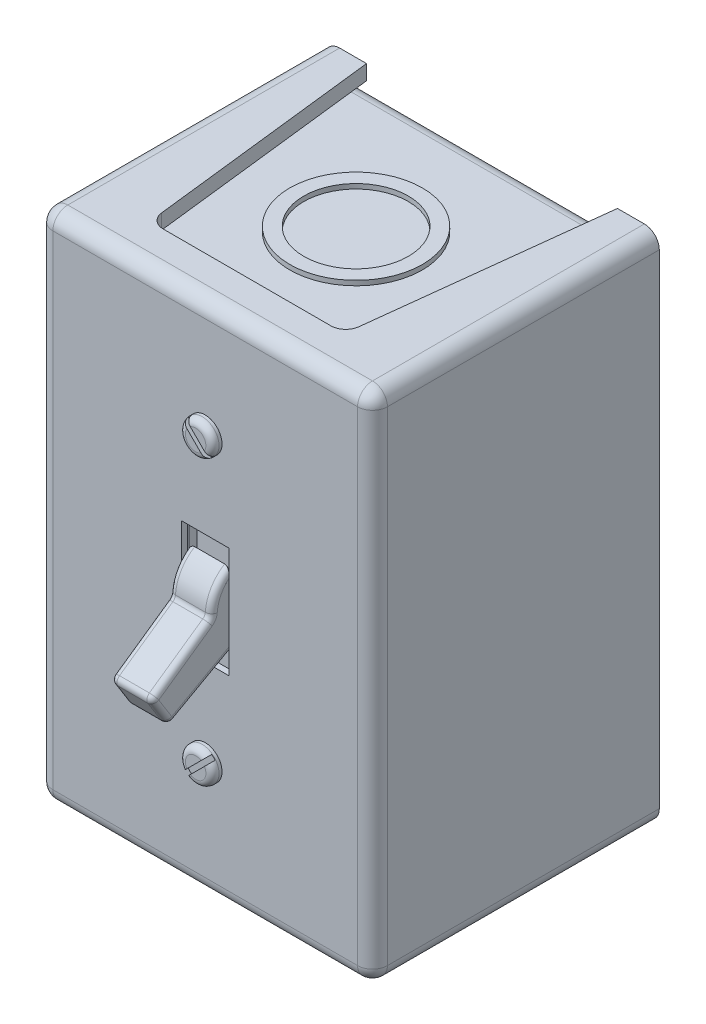
from build123d import *

# Parameters (mm, degrees)
SKETCH1_W               = 71.12
SKETCH1_H               = 109.22
BOSS_EXTRUDE1_DEPTH     = 60.96
FILLET1_R               = 3.175
CUT_EXTRUDE1_DEPTH      = 3.175
SKETCH3_R               = 14.097
SKETCH3_R_2             = 11.1125
BOSS_EXTRUDE5_DEPTH     = 1.016
SKETCH5_W               = 64.77
SKETCH5_H               = 102.87
SKETCH5_W_2             = 63.754
SKETCH5_H_2             = 101.854
CUT_EXTRUDE_THIN1_DEPTH = 53.975
SKETCH4_R               = 3.175
SKETCH4_R_2             = 11.1125
CUT_EXTRUDE3_DEPTH      = 1.016
FILLET6_R               = 3.175
SKETCH9_W               = 10.16
SKETCH9_H               = 23.495
CUT_EXTRUDE6_DEPTH      = 1.27
SKETCH10_W              = 9.525
SKETCH10_H              = 30.1625
CUT_EXTRUDE7_DEPTH      = 1.778
BOSS_EXTRUDE3_DEPTH     = 4.445
FILLET5_R               = 1.27
BODY_MOVE_COPY1_ANGLE   = 32
SKETCH15_R              = 3.57505
BOSS_EXTRUDE6_DEPTH     = 2.032
FILLET7_R               = 1.397
CUT_EXTRUDE_THIN2_DEPTH = 1.27


with BuildPart() as part:
    # Sketch1 → Boss-Extrude1 (new body)
    with BuildSketch(Plane.XY):
        Rectangle(SKETCH1_W, SKETCH1_H)
    extrude(amount=BOSS_EXTRUDE1_DEPTH)

    # Fillet1
    fillet1_edges = [part.edges().sort_by_distance(p)[0] for p in [
        (35.56, 0, 60.96),
        (0, 54.61, 60.96),
        (-35.56, 0, 60.96),
        (0, -54.61, 60.96),
        (-35.56, 54.61, 30.48),
        (35.56, 54.61, 30.48),
        (35.56, -54.61, 30.48),
        (-35.56, -54.61, 30.48),
    ]]
    fillet(fillet1_edges, radius=FILLET1_R)

    # Sketch2 → Cut-Extrude1 (cut)
    with BuildSketch(Plane(origin=(0, 54.61, 0), x_dir=(1, 0, 0), z_dir=(0, 1, 0))):
        with BuildLine():
            Line((-20.963003437, -49.260391385), (-26.67, 0))
            Line((-26.67, 0), (26.67, 0))
            Line((26.67, 0), (20.963003437, -49.260391385))
            ThreePointArc((20.963003437, -49.260391385), (19.921030118, -51.265732234), (17.809098851, -52.07))
            Line((17.809098851, -52.07), (-17.809098851, -52.07))
            ThreePointArc((-17.809098851, -52.07), (-19.921030118, -51.265732234), (-20.963003437, -49.260391385))
        make_face()
    cut_extrude1 = extrude(amount=-CUT_EXTRUDE1_DEPTH, mode=Mode.SUBTRACT)

    # Sketch3 → Boss-Extrude5 (add)
    with BuildSketch(Plane(origin=(0, 51.435, 0), x_dir=(1, 0, 0), z_dir=(0, 1, 0))):
        with Locations(Location((0, -28.8925, 0), (0, 0, 90))):
            Circle(SKETCH3_R)
        with Locations(Location((0, -28.8925, 0), (0, 0, 270))):
            Circle(SKETCH3_R_2, mode=Mode.SUBTRACT)
    boss_extrude5 = extrude(amount=BOSS_EXTRUDE5_DEPTH)

    # Mirror1: Cut-Extrude1, Boss-Extrude5 across plane
    add(cut_extrude1.mirror(Plane.ZX), mode=Mode.SUBTRACT)
    add(boss_extrude5.mirror(Plane.ZX))

    # Sketch5 → Cut-Extrude-Thin1 (cut)
    with BuildSketch(Plane(origin=(0, 0, 0), x_dir=(-1, 0, 0), z_dir=(0, 0, -1))):
        Rectangle(SKETCH5_W, SKETCH5_H)
        Rectangle(SKETCH5_W_2, SKETCH5_H_2, mode=Mode.SUBTRACT)
    extrude(amount=-CUT_EXTRUDE_THIN1_DEPTH, mode=Mode.SUBTRACT)


with BuildPart() as cut_extrude_thin1_piece_1:
    # of the separate pieces the step leaves, piece 1, a body of its own (cut_extrude_thin1_pieces)
    add(part.part.solids().sort_by_distance((-32.385, 54.61, 0))[0])

    # Sketch4 → Cut-Extrude3 (cut)
    with BuildSketch(Plane(origin=(0, 0, 0), x_dir=(-1, 0, 0), z_dir=(0, 0, -1))):
        with Locations((-20.32, 38.1)):
            Circle(SKETCH4_R)
        with Locations((20.32, 38.1)):
            Circle(SKETCH4_R)
        with Locations((20.32, -38.1)):
            Circle(SKETCH4_R)
        with Locations((0, 28.9687)):
            Circle(SKETCH4_R_2)
    extrude(amount=-CUT_EXTRUDE3_DEPTH, mode=Mode.SUBTRACT)

    # Fillet6
    fillet6_edges = [cut_extrude_thin1_piece_1.edges().sort_by_distance(p)[0] for p in [
        (0, 50.927, 0),
        (0, -50.927, 0),
    ]]
    fillet(fillet6_edges, radius=FILLET6_R)

    # Sketch9 → Cut-Extrude6 (cut)
    with BuildSketch(Plane.XY.offset(60.96)):
        Rectangle(SKETCH9_W, SKETCH9_H)
    extrude(amount=-CUT_EXTRUDE6_DEPTH, mode=Mode.SUBTRACT)

    # Sketch10 → Cut-Extrude7 (cut)
    with BuildSketch(Plane.XY.offset(59.69)):
        Rectangle(SKETCH10_W, SKETCH10_H)
    extrude(amount=-CUT_EXTRUDE7_DEPTH, mode=Mode.SUBTRACT)

    # Sketch15 → Boss-Extrude6 (add)
    with BuildSketch(Plane.XY.offset(60.96)):
        with Locations((0, 30.1625)):
            Circle(SKETCH15_R)
        with Locations((0, -30.1625)):
            Circle(SKETCH15_R)
    extrude(amount=BOSS_EXTRUDE6_DEPTH)

    # Fillet7
    fillet7_edges = [cut_extrude_thin1_piece_1.edges().sort_by_distance(p)[0] for p in [
        (-3.57505, 30.1625, 62.992),
        (-3.57505, -30.1625, 62.992),
    ]]
    fillet(fillet7_edges, radius=FILLET7_R)

    # Sketch16 → Cut-Extrude-Thin2 (cut)
    with BuildSketch(Plane.XY.offset(62.992)):
        Polygon((-5.537204514, 34.981284025), (4.818784025, 24.625295486), (5.537204514, 25.343715975), (-4.818784025, 35.699704514), align=None)
    cut_extrude_thin2 = extrude(amount=-CUT_EXTRUDE_THIN2_DEPTH, mode=Mode.SUBTRACT)

    # Mirror3: Cut-Extrude-Thin2 across plane
    add(cut_extrude_thin2.mirror(Plane.ZX), mode=Mode.SUBTRACT)


with BuildPart() as cut_extrude_thin1_piece_2:
    # of the separate pieces the step leaves, piece 2, a body of its own (cut_extrude_thin1_pieces)
    add(part.part.solids().sort_by_distance((0, 51.435, 14.7955))[0])


with BuildPart() as cut_extrude_thin1_piece_3:
    # of the separate pieces the step leaves, piece 3, a body of its own (cut_extrude_thin1_pieces)
    add(part.part.solids().sort_by_distance((0, -51.435, 14.7955))[0])


with BuildPart() as body_4:
    # Sketch11 → Boss-Extrude3 (new, symmetric)
    with BuildSketch(Plane(origin=(0, 0, 0), x_dir=(0, 0, -1), z_dir=(1, 0, 0))):
        with BuildLine():
            Line((-78.486, 3.81), (-78.486, -3.81))
            Line((-78.486, -3.81), (-62.811050749, -4.631489281))
            ThreePointArc((-62.811050749, -4.631489281), (-59.626669695, -7.660806406), (-55.372, -8.763))
            Line((-55.372, -8.763), (-55.372, 8.763))
            ThreePointArc((-55.372, 8.763), (-59.626669695, 7.660806406), (-62.811050749, 4.631489281))
            Line((-62.811050749, 4.631489281), (-78.486, 3.81))
        make_face()
    extrude(amount=BOSS_EXTRUDE3_DEPTH, both=True)

    # Fillet5
    fillet5_edges = [body_4.edges().sort_by_distance(p)[0] for p in [
        (4.445, -4.22074464, 70.648525374),
        (0, 4.631489281, 62.811050749),
        (0, -8.763, 55.372),
        (0, -4.631489281, 62.811050749),
        (0, -3.81, 78.486),
        (0, 3.81, 78.486),
        (4.445, -7.660806406, 59.626669695),
        (4.445, 0, 55.372),
        (4.445, 7.660806406, 59.626669695),
        (4.445, 4.22074464, 70.648525374),
        (-4.445, 7.660806406, 59.626669695),
        (-4.445, 0, 55.372),
        (-4.445, -7.660806406, 59.626669695),
        (4.445, 0, 78.486),
        (-4.445, -4.22074464, 70.648525374),
        (-4.445, 0, 78.486),
        (-4.445, 4.22074464, 70.648525374),
    ]]
    fillet(fillet5_edges, radius=FILLET5_R)


with BuildPart() as body_4_1:
    # Body-Move/Copy1: moved
    add(body_4.part.rotate(Axis((0, 0, 55.372), (1, 0, 0)), BODY_MOVE_COPY1_ANGLE))


solid = Compound([cut_extrude_thin1_piece_1.part, cut_extrude_thin1_piece_2.part, cut_extrude_thin1_piece_3.part, body_4_1.part])
